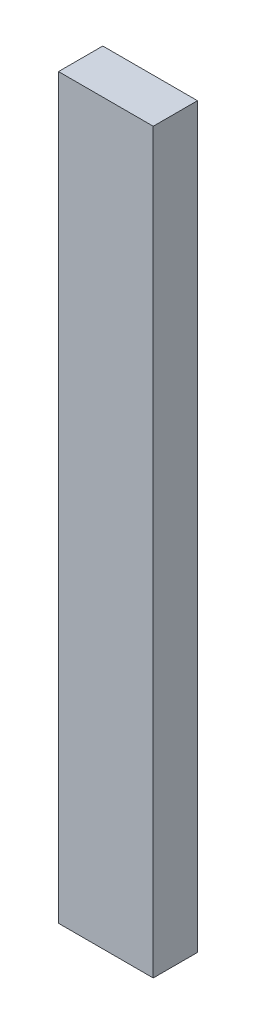
from build123d import *

# Parameters (mm, degrees)
SKETCH1_W           = 6.42
SKETCH1_H           = 50
BOSS_EXTRUDE1_DEPTH = 3


with BuildPart() as part:
    # Sketch1 → Boss-Extrude1 (new body)
    with BuildSketch(Plane.XY):
        with Locations((3.21, 25)):
            Rectangle(SKETCH1_W, SKETCH1_H)
    extrude(amount=BOSS_EXTRUDE1_DEPTH)


solid = part.part
